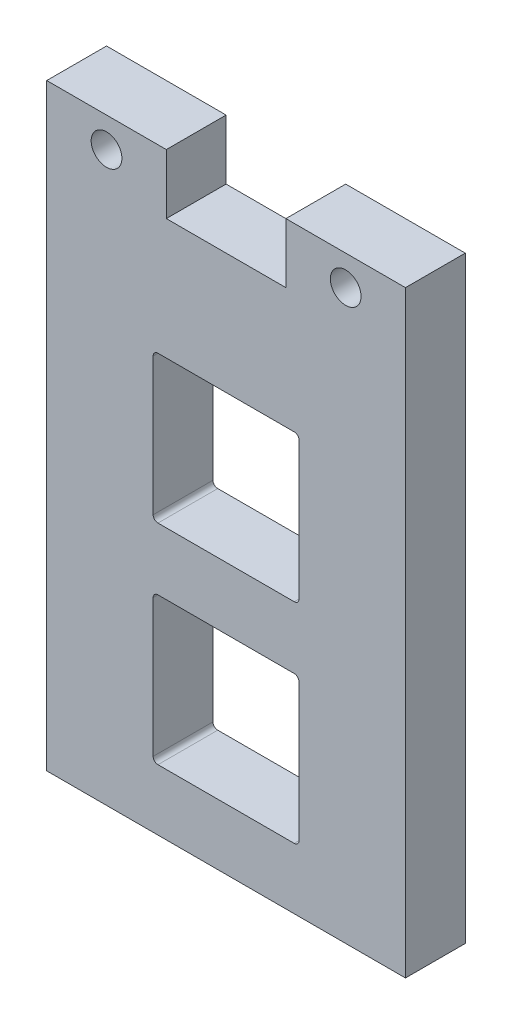
from build123d import *

# Parameters (mm, degrees)
SKETCH1_W             = 38.1
SKETCH1_H             = 63.5
BOSS_EXTRUDE1_DEPTH   = 3.175
F_4_CLEARANCE_HOLE1_D = 3.2639
CUT_EXTRUDE3_REACH    = 76.325
SKETCH6_W             = 12.7
SKETCH6_H             = 6.35
CUT_EXTRUDE4_REACH    = 76.325
SKETCH10_W            = 15.494
SKETCH10_H            = 15.621
LPATTERN1_COUNT       = 2
LPATTERN1_PITCH       = 22.225
FILLET1_R             = 0.508


with BuildPart() as part:
    # Sketch1 → Boss-Extrude1 (new, symmetric)
    with BuildSketch(Plane.XY):
        with Locations((19.05, -31.75)):
            Rectangle(SKETCH1_W, SKETCH1_H)
    extrude(amount=BOSS_EXTRUDE1_DEPTH, both=True)

    # #4 Clearance Hole1 (through all)
    with Locations(Plane.XY.offset(3.175)):
        with Locations((6.35, -3.175), (31.75, -3.175)):
            Hole(F_4_CLEARANCE_HOLE1_D / 2)

    # Sketch6 → Cut-Extrude3 (cut, up to next)
    with BuildSketch(Plane.XY.offset(3.175), mode=Mode.PRIVATE) as cut_extrude3_sk1:
        with Locations((19.05, -3.175)):
            Rectangle(SKETCH6_W, SKETCH6_H)
    cut_extrude3_tool1 = extrude(cut_extrude3_sk1.sketch, amount=-CUT_EXTRUDE3_REACH, mode=Mode.PRIVATE) & part.part
    add(cut_extrude3_tool1.solids().sort_by_distance((19.05, -3.175, 3.175))[0], mode=Mode.SUBTRACT)

    # Sketch10 → Cut-Extrude4 (cut, up to next)
    with BuildSketch(Plane(origin=(0, 0, -3.175), x_dir=(-1, 0, 0), z_dir=(0, 0, -1)), mode=Mode.PRIVATE) as cut_extrude4_sk1:
        with Locations((-19.05, -26.9875)):
            Rectangle(SKETCH10_W, SKETCH10_H)
    cut_extrude4_tool1 = extrude(cut_extrude4_sk1.sketch, amount=-CUT_EXTRUDE4_REACH, mode=Mode.PRIVATE) & part.part
    cut_extrude4 = cut_extrude4_tool1.solids().sort_by_distance((19.05, -26.9875, -3.175))[0]
    add(cut_extrude4, mode=Mode.SUBTRACT)

    # LPattern1: Cut-Extrude4 ×2
    with Locations(*[(0, -i * LPATTERN1_PITCH, 0) for i in range(1, LPATTERN1_COUNT)]):
        add(cut_extrude4, mode=Mode.SUBTRACT)

    # Fillet1
    fillet1_edges = [part.edges().sort_by_distance(p)[0] for p in [
        (11.303, -19.177, 0),
        (11.303, -34.798, 0),
        (26.797, -34.798, 0),
        (26.797, -19.177, 0),
        (11.303, -41.402, 0),
        (11.303, -57.023, 0),
        (26.797, -57.023, 0),
        (26.797, -41.402, 0),
    ]]
    fillet(fillet1_edges, radius=FILLET1_R)


solid = part.part
